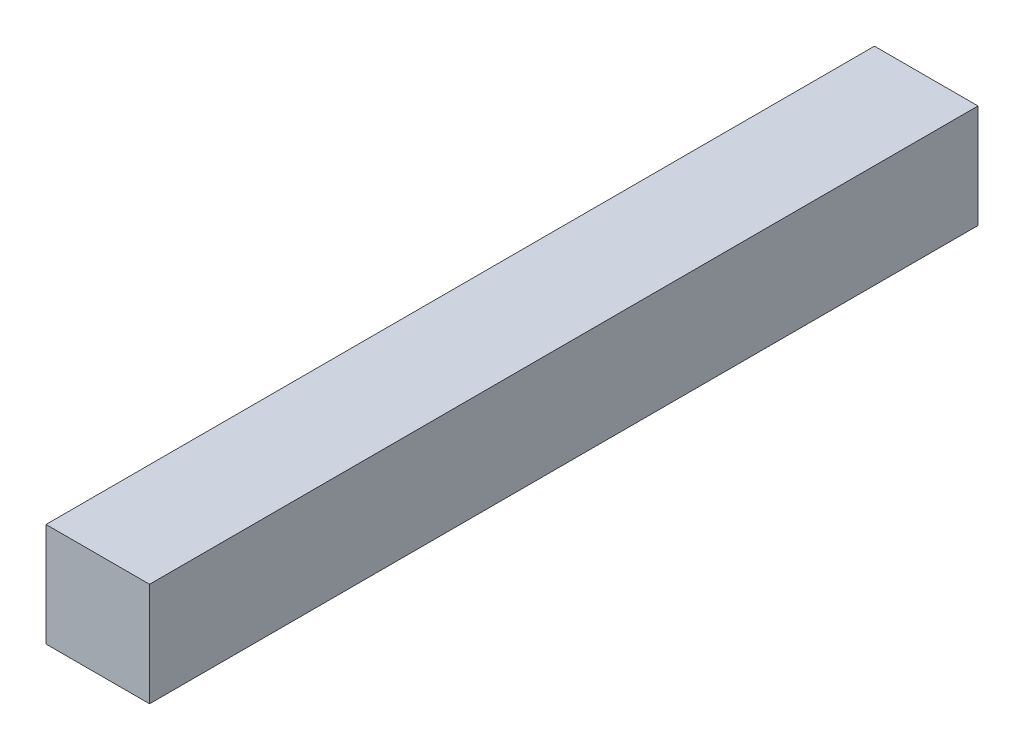
from build123d import *

# Parameters (mm, degrees)
IZIM1_W                     = 25
IZIM1_H                     = 25
Y_KSEKLIK_EKSTR_ZYON1_DEPTH = 200


with BuildPart() as part:
    # Çizim1 → Yükseklik-Ekstrüzyon1 (new body)
    with BuildSketch(Plane.XY):
        Rectangle(IZIM1_W, IZIM1_H)
    extrude(amount=-Y_KSEKLIK_EKSTR_ZYON1_DEPTH)


solid = part.part
